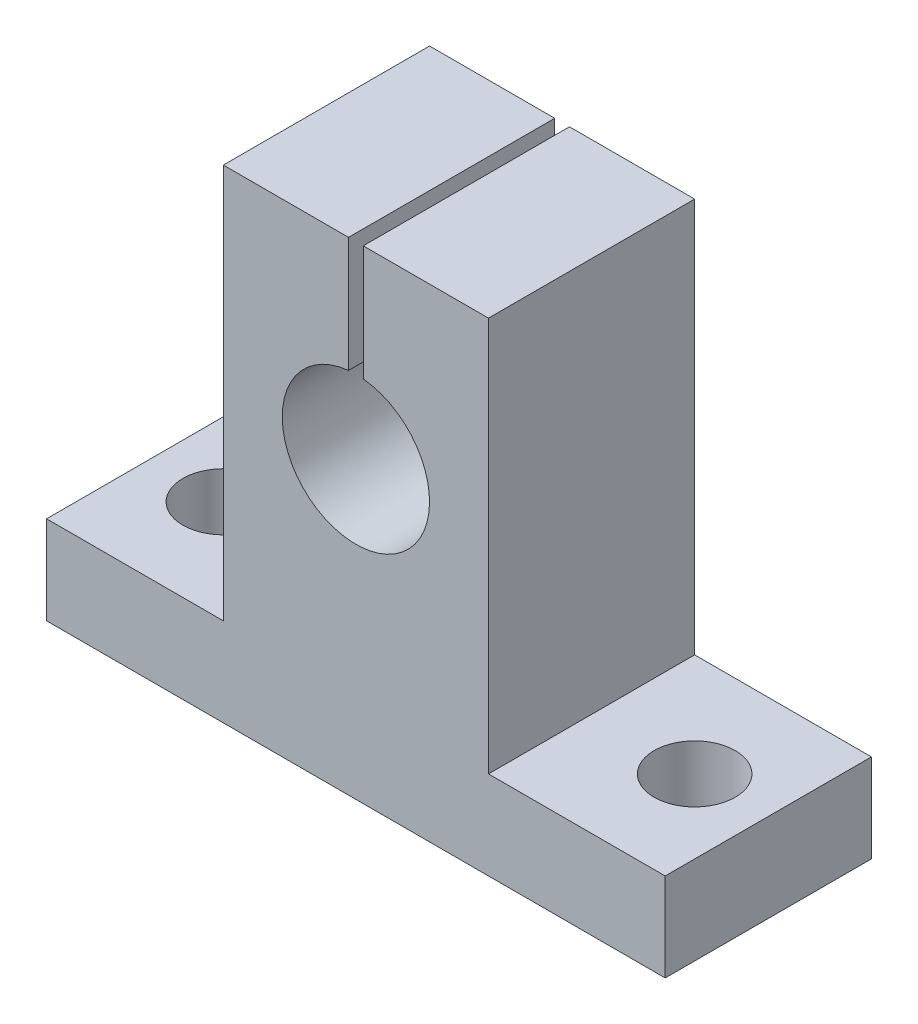
from build123d import *

# Parameters (mm, degrees)
SKETCH1_R           = 5
BOSS_EXTRUDE1_DEPTH = 14
SKETCH2_W           = 1
SKETCH2_H           = 15.34768378
CUT_EXTRUDE1_DEPTH  = 33.202484376
SKETCH3_R           = 2.75
CUT_EXTRUDE2_DEPTH  = 37.813584449


with BuildPart() as part:
    # Sketch1 → Boss-Extrude1 (new body)
    with BuildSketch(Plane.XY):
        Polygon((9, 12.8), (-9, 12.8), (-9, -14), (-21, -14), (-21, -20), (21, -20), (21, -14), (9, -14), align=None)
        Circle(SKETCH1_R, mode=Mode.SUBTRACT)
    extrude(amount=BOSS_EXTRUDE1_DEPTH)

    # Sketch2 → Cut-Extrude1 (cut, through all)
    with BuildSketch(Plane.XY.offset(14)):
        with Locations((0, 7.003057882)):
            Rectangle(SKETCH2_W, SKETCH2_H)
    extrude(amount=-CUT_EXTRUDE1_DEPTH, mode=Mode.SUBTRACT)

    # Sketch3 → Cut-Extrude2 (cut, through all)
    with BuildSketch(Plane(origin=(0, -14, 0), x_dir=(1, 0, 0), z_dir=(0, 1, 0))):
        with Locations(Location((-16, -7, 0), (0, 0, 270))):
            Circle(SKETCH3_R)
        with Locations(Location((16, -7, 0), (0, 0, 90))):
            Circle(SKETCH3_R)
    extrude(amount=-CUT_EXTRUDE2_DEPTH, mode=Mode.SUBTRACT)


solid = part.part
